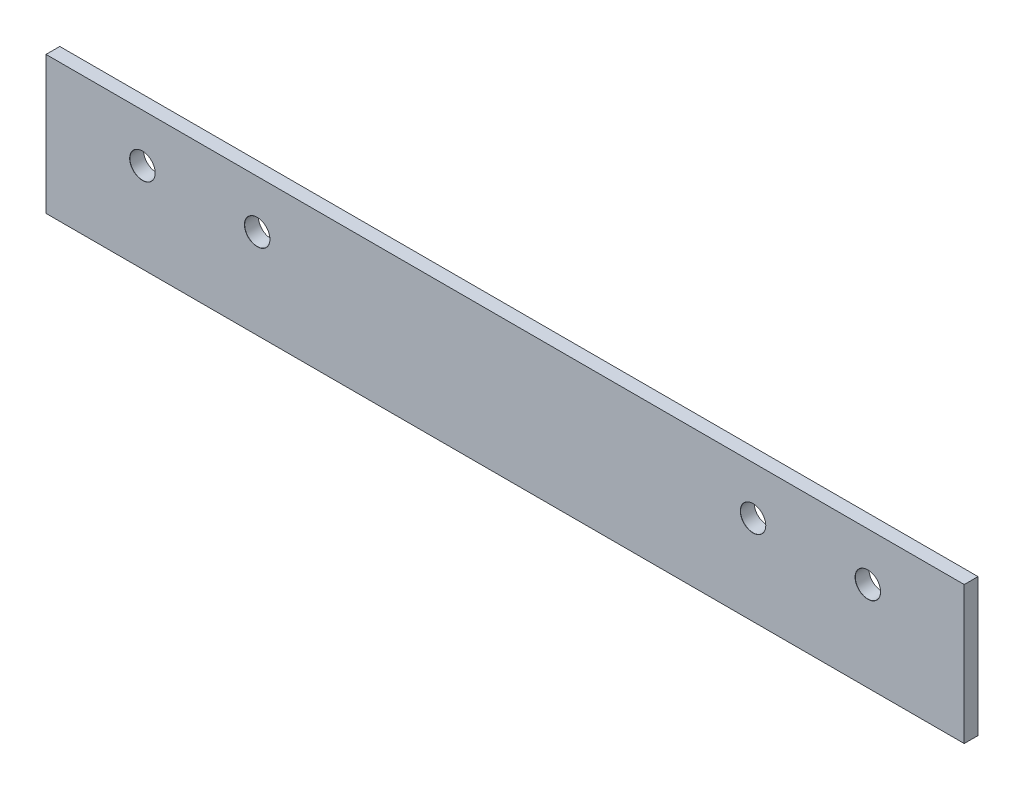
from build123d import *

# Parameters (mm, degrees)
SKETCH1_W                      = 200
SKETCH1_H                      = 30
BOSS_EXTRUDE1_DEPTH            = 1.5
M5_CLEARANCE_HOLE1_D           = 5.5
M5_CLEARANCE_HOLE1_CSINK_D     = 5.55
M5_CLEARANCE_HOLE1_CSINK_ANGLE = 90


with BuildPart() as part:
    # Sketch1 → Boss-Extrude1 (new, symmetric)
    with BuildSketch(Plane.XY):
        Rectangle(SKETCH1_W, SKETCH1_H)
    extrude(amount=BOSS_EXTRUDE1_DEPTH, both=True)

    # M5 Clearance Hole1 (through all)
    with Locations(Plane.XY.offset(1.5)):
        with Locations((54, 4.5), (-79, 4.5), (-54, 4.5), (79, 4.5)):
            CounterSinkHole(M5_CLEARANCE_HOLE1_D / 2, M5_CLEARANCE_HOLE1_CSINK_D / 2, counter_sink_angle=M5_CLEARANCE_HOLE1_CSINK_ANGLE)


solid = part.part
